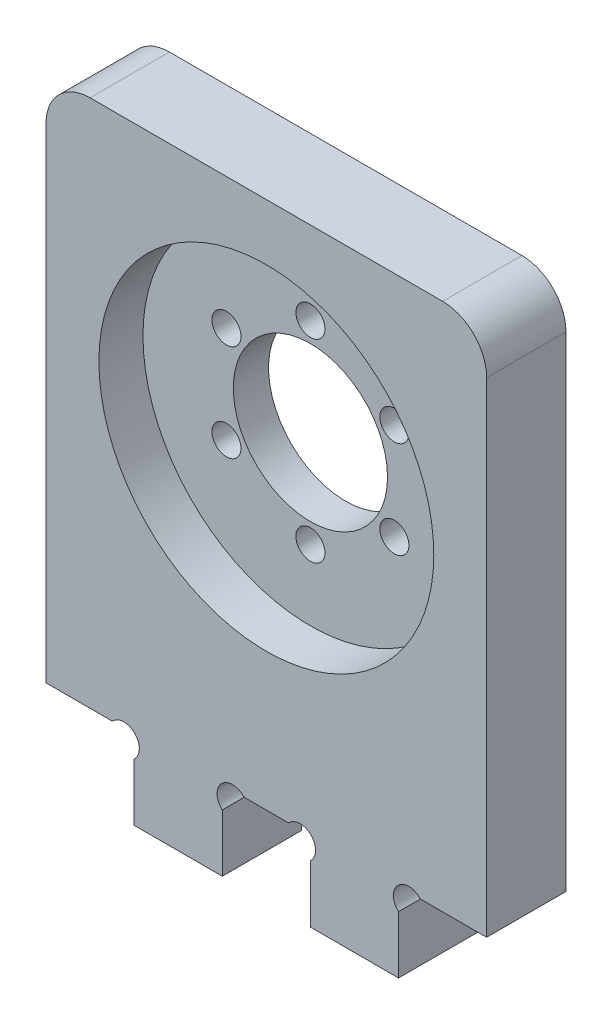
from build123d import *

# Parameters (mm, degrees)
ESQUISSE1_W                  = 50
ESQUISSE1_H                  = 60
BOSS_EXTRU_1_DEPTH           = 9
ESQUISSE2_W                  = 10
ESQUISSE2_H                  = 9
BOSS_EXTRU_2_DEPTH           = 9
ESQUISSE3_R                  = 8.75
ESQUISSE3_R_2                = 1.65
ENL_V_MAT_EXTRU_1_DEPTH      = 9
ESQUISSE4_R                  = 19
ENL_V_MAT_EXTRU_2_DEPTH      = 5
CONG_1_R                     = 5
ENL_V_MAT_EXTRU_3_DEPTH      = 79.619336044
ENL_V_MAT_EXTRU_3_DEPTH_BACK = 79.619336044


with BuildPart() as part:
    # Esquisse1 → Boss.-Extru.1 (new body)
    with BuildSketch(Plane.XY):
        with Locations((25, 30)):
            Rectangle(ESQUISSE1_W, ESQUISSE1_H)
    extrude(amount=BOSS_EXTRU_1_DEPTH)

    # Esquisse2 → Boss.-Extru.2 (add)
    with BuildSketch(Plane.XY.offset(9)):
        with Locations((35, -4.5)):
            Rectangle(ESQUISSE2_W, ESQUISSE2_H)
        with Locations((15, -4.5)):
            Rectangle(ESQUISSE2_W, ESQUISSE2_H)
    extrude(amount=-BOSS_EXTRU_2_DEPTH)

    # Esquisse3 → Enlèv. mat.-Extru.1 (cut)
    with BuildSketch(Plane.XY.offset(9)):
        with Locations((25, 34.6)):
            Circle(ESQUISSE3_R)
        with Locations((25, 45.6)):
            Circle(ESQUISSE3_R_2)
        with Locations((34.526279442, 40.1)):
            Circle(ESQUISSE3_R_2)
        with Locations((34.526279442, 29.1)):
            Circle(ESQUISSE3_R_2)
        with Locations((25, 23.6)):
            Circle(ESQUISSE3_R_2)
        with Locations((15.473720558, 29.1)):
            Circle(ESQUISSE3_R_2)
        with Locations((15.473720558, 40.1)):
            Circle(ESQUISSE3_R_2)
    extrude(amount=-ENL_V_MAT_EXTRU_1_DEPTH, mode=Mode.SUBTRACT)

    # Esquisse4 → Enlèv. mat.-Extru.2 (cut)
    with BuildSketch(Plane.XY.offset(9)):
        with Locations((25, 34.6)):
            Circle(ESQUISSE4_R)
    extrude(amount=-ENL_V_MAT_EXTRU_2_DEPTH, mode=Mode.SUBTRACT)

    # Congé1
    cong_1_edges = [part.edges().sort_by_distance(p)[0] for p in [
        (0, 60, 4.5),
        (50, 60, 4.5),
    ]]
    fillet(cong_1_edges, radius=CONG_1_R)

    # Esquisse5 → Enlèv. mat.-Extru.3 (cut, two sides: drawn at the far end of the back side and taken through both)
    with BuildSketch(Plane.XY.offset(9).offset(-ENL_V_MAT_EXTRU_3_DEPTH_BACK)):
        with BuildLine():
            Line((27.525126266, 0), (30, -2.474873734))
            ThreePointArc((30, -2.474873734), (30.070710678, 0.070710678), (27.525126266, 0))
        make_face()
        with BuildLine():
            Line((22.474873734, 0), (20, -2.474873734))
            ThreePointArc((20, -2.474873734), (19.929289322, 0.070710678), (22.474873734, 0))
        make_face()
        with BuildLine():
            Line((42.474873734, 0), (40, -2.474873734))
            ThreePointArc((40, -2.474873734), (39.929289322, 0.070710678), (42.474873734, 0))
        make_face()
        with BuildLine():
            Line((7.525126266, 0), (10, -2.474873734))
            ThreePointArc((10, -2.474873734), (10.070710678, 0.070710678), (7.525126266, 0))
        make_face()
    extrude(amount=ENL_V_MAT_EXTRU_3_DEPTH + ENL_V_MAT_EXTRU_3_DEPTH_BACK, mode=Mode.SUBTRACT)


solid = part.part
